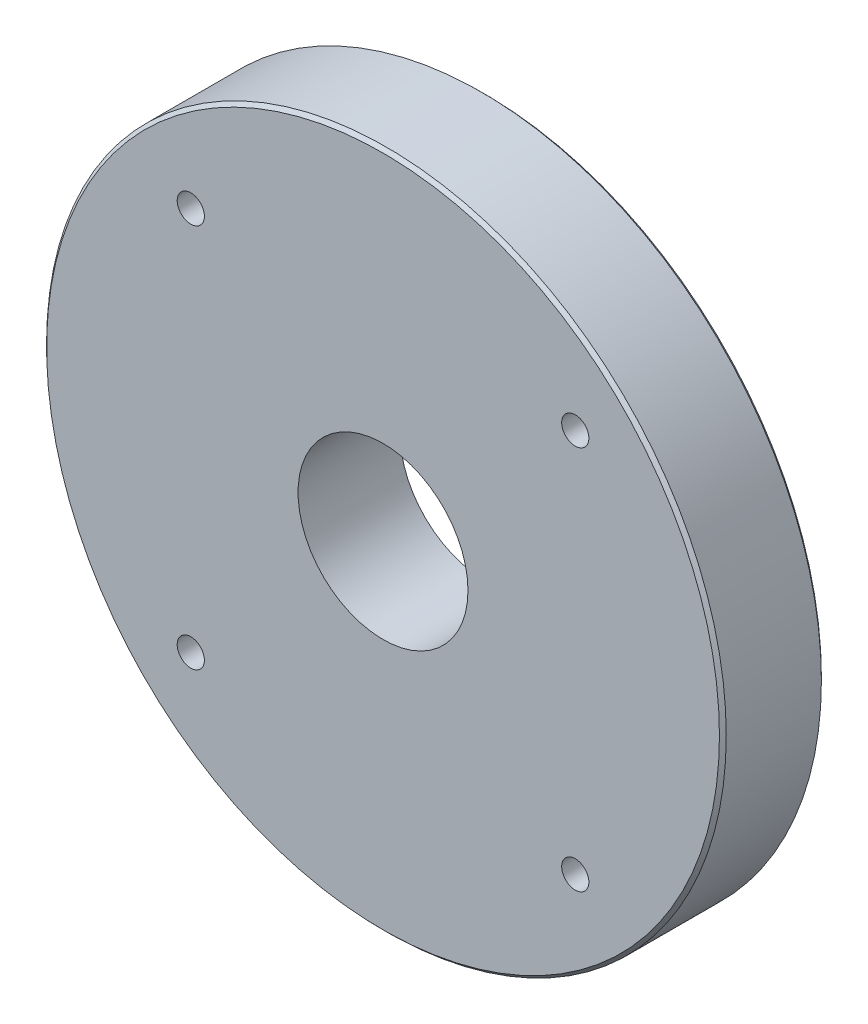
from build123d import *

# Parameters (mm, degrees)
SKETCH1_R           = 100
BOSS_EXTRUDE1_DEPTH = 30
SKETCH2_R           = 25
CUT_EXTRUDE2_DEPTH  = 40
SKETCH3_R           = 4
CUT_EXTRUDE3_DEPTH  = 40
CHAMFER1_SIZE       = 1
CHAMFER2_SIZE       = 1


with BuildPart() as part:
    # Sketch1 → Boss-Extrude1 (new body)
    with BuildSketch(Plane.XY):
        Circle(SKETCH1_R)
    extrude(amount=BOSS_EXTRUDE1_DEPTH)

    # Sketch2 → Cut-Extrude2 (cut)
    with BuildSketch(Plane.XY):
        Circle(SKETCH2_R)
    extrude(amount=CUT_EXTRUDE2_DEPTH, mode=Mode.SUBTRACT)

    # Sketch3 → Cut-Extrude3 (cut)
    with BuildSketch(Plane.XY.offset(30)):
        with Locations((56.568542495, 56.568542495)):
            Circle(SKETCH3_R)
        with Locations((-56.568542495, 56.568542495)):
            Circle(SKETCH3_R)
        with Locations((-56.568542495, -56.568542495)):
            Circle(SKETCH3_R)
        with Locations((56.568542495, -56.568542495)):
            Circle(SKETCH3_R)
    extrude(amount=-CUT_EXTRUDE3_DEPTH, mode=Mode.SUBTRACT)

    # Chamfer1
    chamfer1_edges = [part.edges().sort_by_distance(p)[0] for p in [
        (-100, 0, 0),
    ]]
    chamfer(chamfer1_edges, length=CHAMFER1_SIZE)

    # Chamfer2
    chamfer2_edges = [part.edges().sort_by_distance(p)[0] for p in [
        (-100, 0, 30),
    ]]
    chamfer(chamfer2_edges, length=CHAMFER2_SIZE)


solid = part.part
